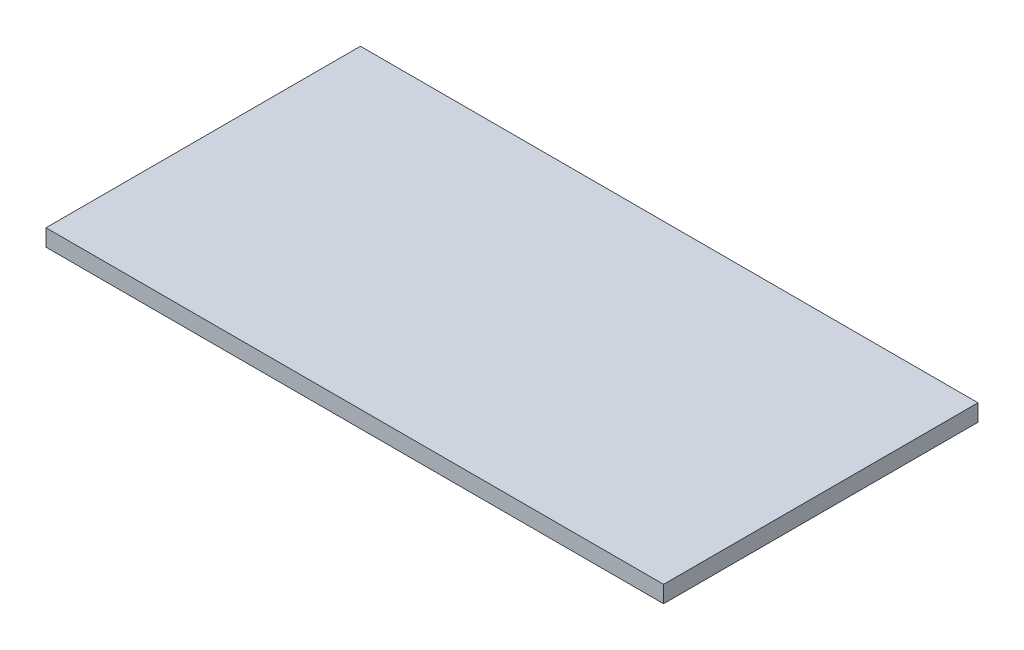
from build123d import *

# Parameters (mm, degrees)
SKETCH1_W           = 220
SKETCH1_H           = 112
BOSS_EXTRUDE1_DEPTH = 6


with BuildPart() as part:
    # Sketch1 → Boss-Extrude1 (new body)
    with BuildSketch(Plane(origin=(0, 0, 0), x_dir=(1, 0, 0), z_dir=(0, 1, 0))):
        with Locations((19.979493452, -6.091943321)):
            Rectangle(SKETCH1_W, SKETCH1_H)
    extrude(amount=BOSS_EXTRUDE1_DEPTH)


solid = part.part
